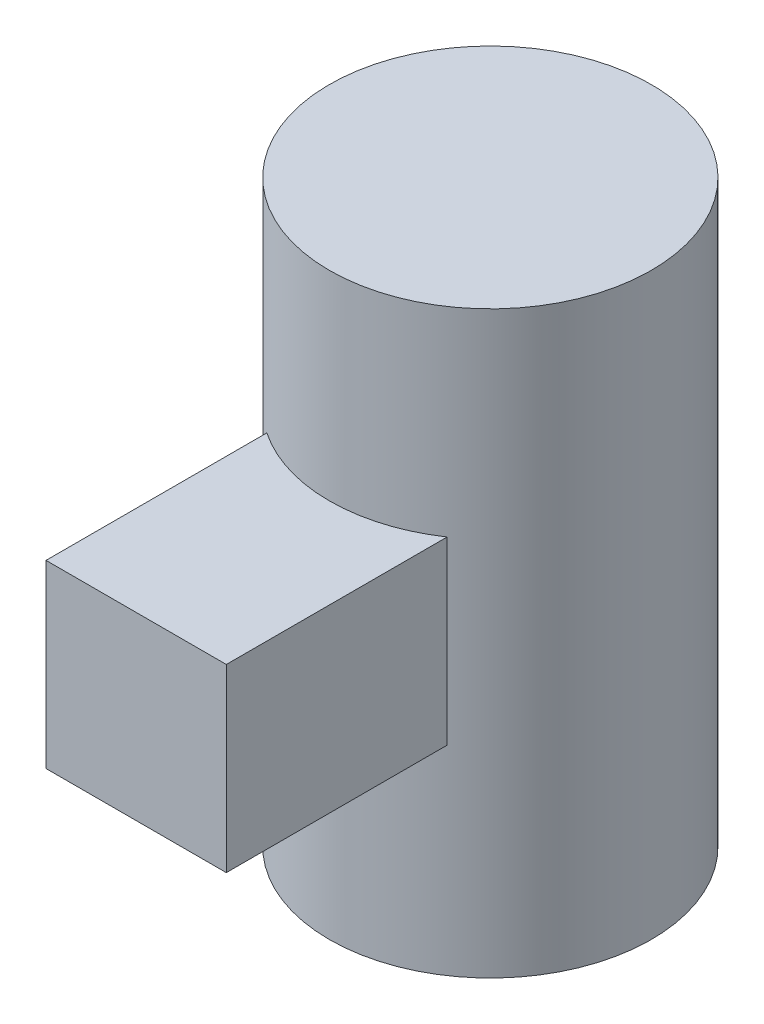
from build123d import *

# Parameters (mm, degrees)
SKETCH2_R           = 31.75
BOSS_EXTRUDE1_DEPTH = 57.15
SKETCH3_W           = 35.56
SKETCH3_H           = 35.56
BOSS_EXTRUDE2_DEPTH = 69.85


with BuildPart() as part:
    # Sketch2 → Boss-Extrude1 (new, symmetric)
    with BuildSketch(Plane(origin=(0, 0, 0), x_dir=(1, 0, 0), z_dir=(0, 1, 0))):
        with Locations(Location((0, 0, 0), (0, 0, 270))):
            Circle(SKETCH2_R)
    extrude(amount=BOSS_EXTRUDE1_DEPTH, both=True)

    # Sketch3 → Boss-Extrude2 (add)
    with BuildSketch(Plane.XY):
        Rectangle(SKETCH3_W, SKETCH3_H)
    extrude(amount=BOSS_EXTRUDE2_DEPTH)


solid = part.part
